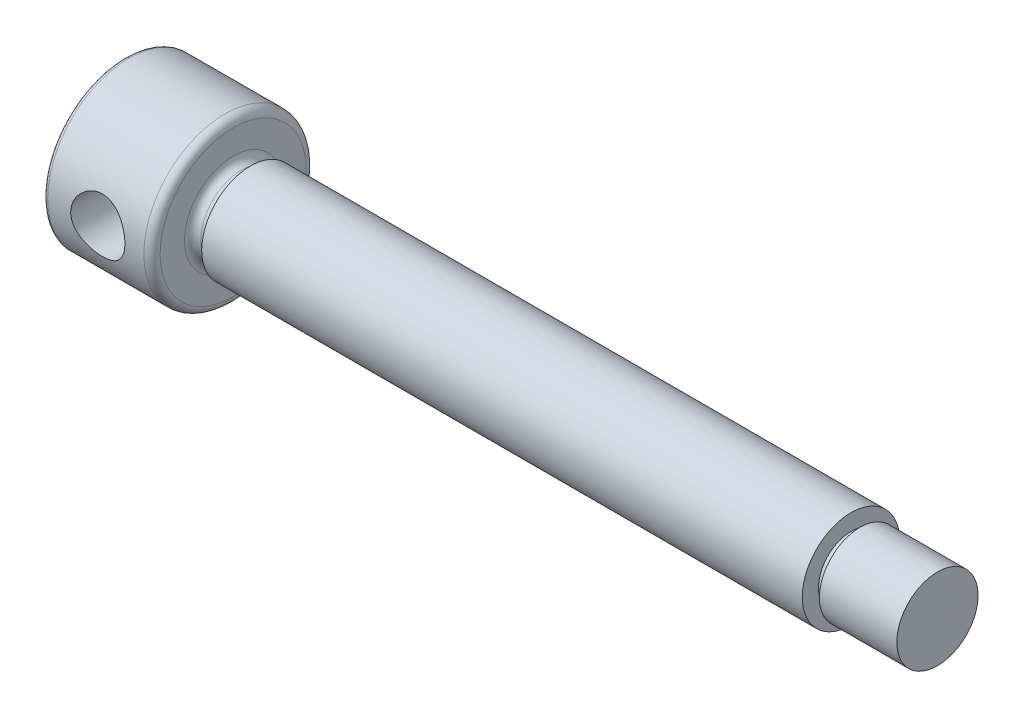
from build123d import *

# Parameters (mm, degrees)
FILLET1_R          = 1.5
SKETCH3_R          = 10
CUT_EXTRUDE1_DEPTH = 136.5
FILLET2_R          = 3
FILLET3_R          = 3


with BuildPart() as part:
    # Sketch1 → Revolve1 (revolve)
    with BuildSketch(Plane.XY, mode=Mode.PRIVATE) as revolve1_sk:
        Polygon((0, 0), (300, 0), (300, 15), (271.419940235, 15), (271.419940235, 12), (268.089940235, 12), (268.089940235, 18), (46.35, 18), (46.35, 15), (40, 15), (40, 30), (0, 30), align=None)
    revolve(revolve1_sk.sketch.rotate(Axis((0, 0, 0), (1, 0, 0)), 90), axis=Axis((0, 0, 0), (1, 0, 0)))

    # Fillet1
    fillet1_edges = [part.edges().sort_by_distance(p)[0] for p in [
        (0, 0, -30),
    ]]
    fillet(fillet1_edges, radius=FILLET1_R)

    # Sketch3 → Cut-Extrude1 (cut, symmetric)
    with BuildSketch(Plane.XY):
        with Locations((20, 0)):
            Circle(SKETCH3_R)
    extrude(amount=CUT_EXTRUDE1_DEPTH, both=True, mode=Mode.SUBTRACT)

    # Fillet2
    fillet2_edges = [part.edges().sort_by_distance(p)[0] for p in [
        (40, 0, -15),
    ]]
    fillet(fillet2_edges, radius=FILLET2_R)

    # Fillet3
    fillet3_edges = [part.edges().sort_by_distance(p)[0] for p in [
        (40, 0, -30),
    ]]
    fillet(fillet3_edges, radius=FILLET3_R)


solid = part.part
